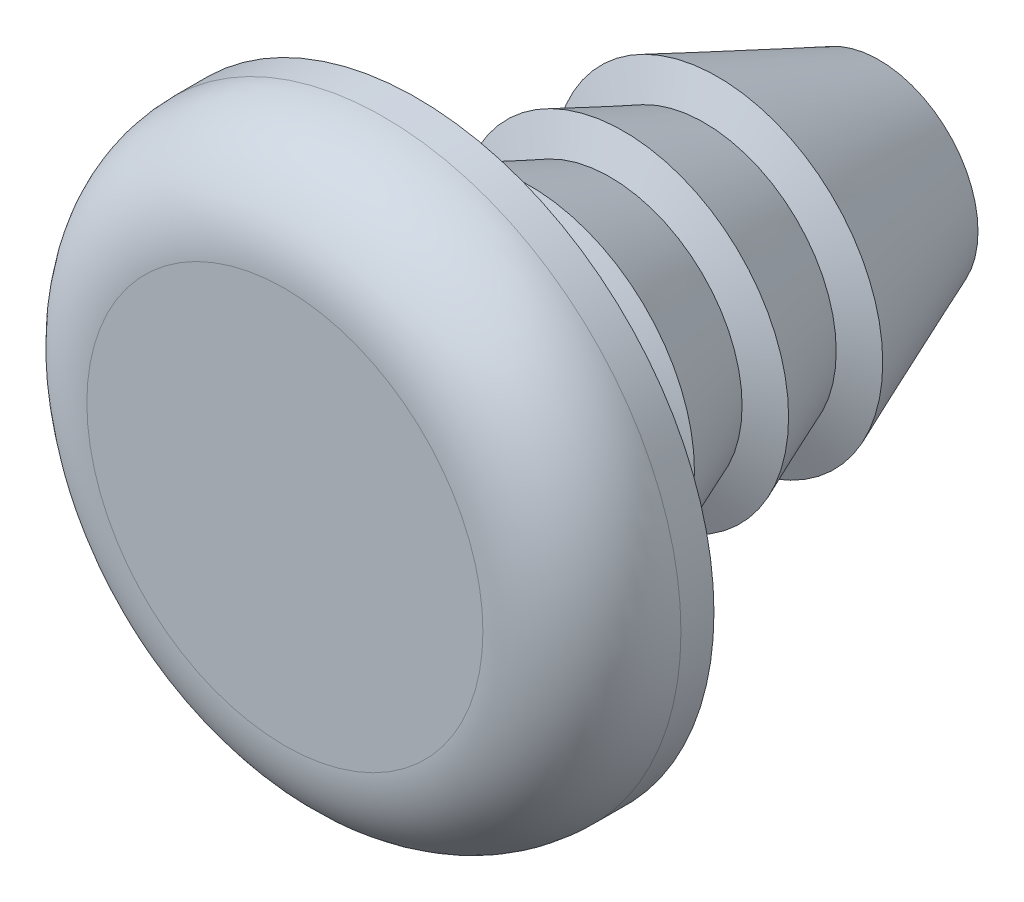
from build123d import *


with BuildPart() as part:
    # 草图1 → 旋转1 (revolve)
    with BuildSketch(Plane(origin=(0, 0, 0), x_dir=(0, 0, -1), z_dir=(1, 0, 0)), mode=Mode.PRIVATE) as revolve_1_sk:
        with BuildLine():
            Line((0, 4.5), (-0.5, 4.5))
            ThreePointArc((-0.5, 4.5), (-1.560660172, 4.060660172), (-2, 3))
            Line((-2, 3), (-2, 0))
            Line((-2, 0), (7, 0))
            Line((7, 0), (7, 1.5))
            Line((7, 1.5), (4.556999532, 2.5))
            Line((4.556999532, 2.5), (4.352333177, 2))
            Line((4.352333177, 2), (3.130832943, 2.5))
            Line((3.130832943, 2.5), (2.926166589, 2))
            Line((2.926166589, 2), (1.704666355, 2.5))
            Line((1.704666355, 2.5), (1.5, 2))
            Line((1.5, 2), (0, 2))
            Line((0, 2), (0, 4.5))
        make_face()
    revolve(revolve_1_sk.sketch.rotate(Axis((0, 0, 35.672992327), (0, 0, -1)), 90), axis=Axis((0, 0, 35.672992327), (0, 0, -1)))


solid = part.part
